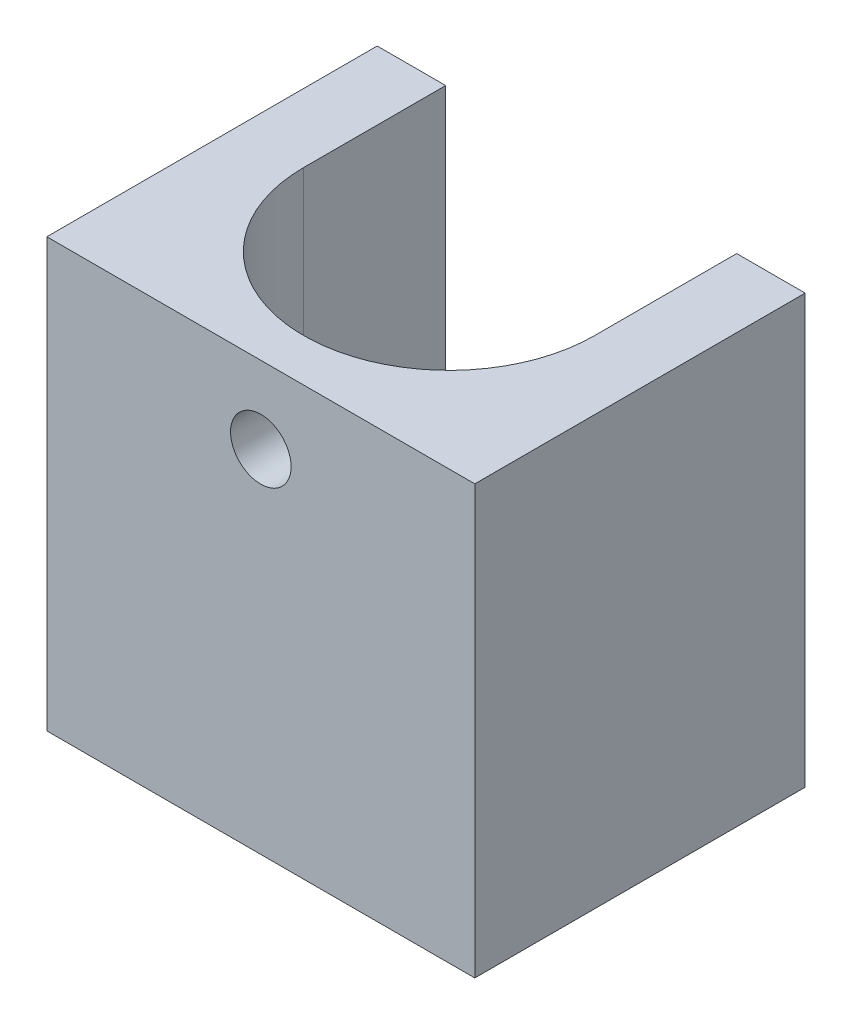
from build123d import *

# Parameters (mm, degrees)
SKETCH1_W           = 31.75
SKETCH1_H           = 3.175
BOSS_EXTRUDE1_DEPTH = 31.75
BOSS_EXTRUDE2_DEPTH = 31.75
SKETCH3_W           = 5.08
SKETCH3_H           = 10.541
BOSS_EXTRUDE3_DEPTH = 31.75
SKETCH4_R           = 2.2463125
SKETCH4_R_2         = 2.1193125
CUT_EXTRUDE1_DEPTH  = 31.75
SKETCH6_R           = 2.1193125
BOSS_EXTRUDE4_DEPTH = 15.875
FILLET1_R           = 0.762


with BuildPart() as part:
    # Sketch1 → Boss-Extrude1 (new body)
    with BuildSketch(Plane(origin=(0, 0, 0), x_dir=(1, 0, 0), z_dir=(0, 1, 0))):
        Rectangle(SKETCH1_W, SKETCH1_H)
    extrude(amount=BOSS_EXTRUDE1_DEPTH)

    # Sketch2 → Boss-Extrude2 (add)
    with BuildSketch(Plane(origin=(0, 31.75, 0), x_dir=(1, 0, 0), z_dir=(0, 1, 0))):
        with BuildLine():
            Line((-15.875, 1.5875), (-15.875, 12.3825))
            Line((-15.875, 12.3825), (-10.795, 12.3825))
            ThreePointArc((-10.795, 12.3825), (-7.633217703, 4.749282297), (0, 1.5875))
            Line((0, 1.5875), (-15.875, 1.5875))
        make_face()
    boss_extrude2 = extrude(amount=-BOSS_EXTRUDE2_DEPTH)

    # Mirror1: Boss-Extrude2 across plane
    add(boss_extrude2.mirror(Plane(origin=(0, 0, 0), x_dir=(0, 0, 1), z_dir=(1, 0, 0))))

    # Sketch3 → Boss-Extrude3 (add)
    with BuildSketch(Plane(origin=(0, 31.75, 0), x_dir=(1, 0, 0), z_dir=(0, 1, 0))):
        with Locations((-13.335, 17.653)):
            Rectangle(SKETCH3_W, SKETCH3_H)
    boss_extrude3 = extrude(amount=-BOSS_EXTRUDE3_DEPTH)

    # Mirror2: Boss-Extrude3 across plane
    add(boss_extrude3.mirror(Plane(origin=(0, 0, 0), x_dir=(0, 0, 1), z_dir=(1, 0, 0))))

    # Sketch4 → Cut-Extrude1 (cut)
    with BuildSketch(Plane.XY.offset(1.5875)):
        with Locations((0, 26.035)):
            Circle(SKETCH4_R)
        with Locations((0, 5.715)):
            Circle(SKETCH4_R_2)
    extrude(amount=-CUT_EXTRUDE1_DEPTH, mode=Mode.SUBTRACT)

    # Sketch6 → Boss-Extrude4 (add)
    with BuildSketch(Plane.XY.offset(1.5875)):
        with Locations((0, 5.715)):
            Circle(SKETCH6_R)
    extrude(amount=-BOSS_EXTRUDE4_DEPTH)

    # Fillet1
    fillet1_edges = [part.edges().sort_by_distance(p)[0] for p in [
        (-2.1193125, 5.715, -14.2875),
    ]]
    fillet(fillet1_edges, radius=FILLET1_R)


solid = part.part
